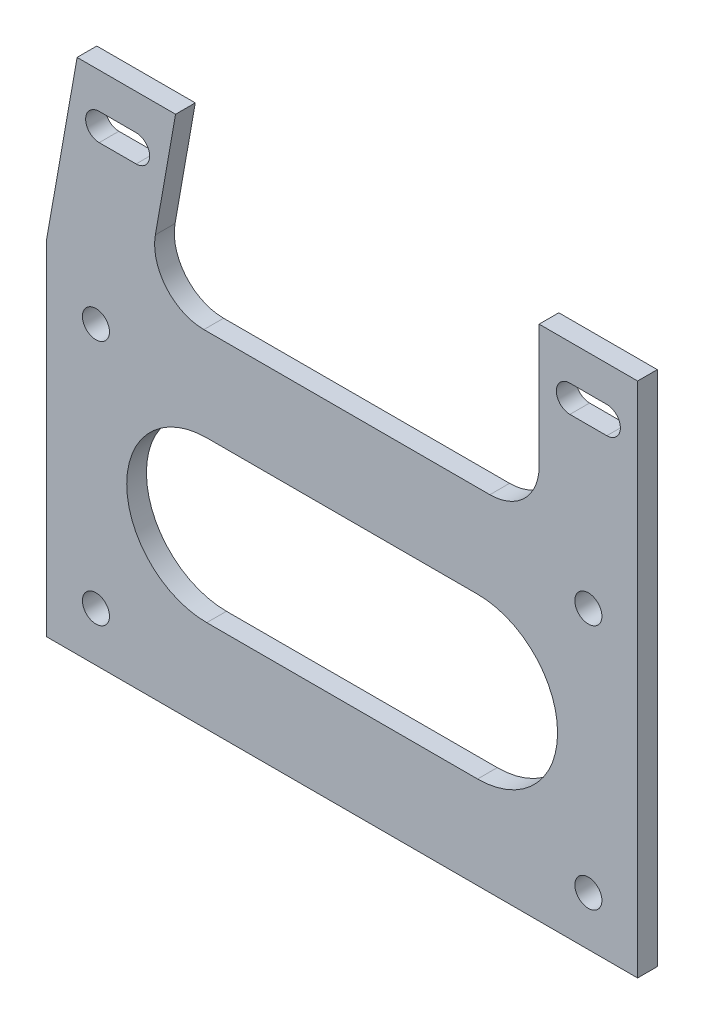
from build123d import *

# Parameters (mm, degrees)
SKETCH1_R           = 2.75
BOSS_EXTRUDE1_DEPTH = 4


with BuildPart() as part:
    # Sketch1 → Boss-Extrude1 (new body)
    with BuildSketch(Plane.XY):
        with BuildLine():
            Line((-60, 35), (-53.828555675, 70))
            Line((-53.828555675, 70), (-33.828555675, 70))
            Line((-33.828555675, 70), (-37.930541604, 46.736481777))
            ThreePointArc((-37.930541604, 46.736481777), (-35.742908505, 38.572123903), (-28.082464074, 35))
            Line((-28.082464074, 35), (30, 35))
            ThreePointArc((30, 35), (37.071067812, 37.928932188), (40, 45))
            Line((40, 45), (40, 70))
            Line((40, 70), (60, 70))
            Line((60, 70), (60, 35))
            Line((60, 35), (60, -35))
            Line((60, -35), (-60, -35))
            Line((-60, -35), (-60, 35))
        make_face()
        with Locations((-50, 25)):
            Circle(SKETCH1_R, mode=Mode.SUBTRACT)
        with Locations((-50, -25)):
            Circle(SKETCH1_R, mode=Mode.SUBTRACT)
        with Locations((50, 25)):
            Circle(SKETCH1_R, mode=Mode.SUBTRACT)
        with Locations((50, -25)):
            Circle(SKETCH1_R, mode=Mode.SUBTRACT)
        with BuildLine():
            Line((-49.341825482, 57.25), (-41.841825482, 57.25))
            ThreePointArc((-41.841825482, 57.25), (-39.091825482, 60), (-41.841825482, 62.75))
            Line((-41.841825482, 62.75), (-49.341825482, 62.75))
            ThreePointArc((-49.341825482, 62.75), (-52.091825482, 60), (-49.341825482, 57.25))
        make_face(mode=Mode.SUBTRACT)
        with BuildLine():
            Line((-27.5, -16.25), (27.5, -16.25))
            ThreePointArc((27.5, -16.25), (43.75, 0), (27.5, 16.25))
            Line((27.5, 16.25), (-27.5, 16.25))
            ThreePointArc((-27.5, 16.25), (-43.75, 0), (-27.5, -16.25))
        make_face(mode=Mode.SUBTRACT)
        with BuildLine():
            Line((46.25, 57.25), (53.75, 57.25))
            ThreePointArc((53.75, 57.25), (56.5, 60), (53.75, 62.75))
            Line((53.75, 62.75), (46.25, 62.75))
            ThreePointArc((46.25, 62.75), (43.5, 60), (46.25, 57.25))
        make_face(mode=Mode.SUBTRACT)
    extrude(amount=BOSS_EXTRUDE1_DEPTH)


solid = part.part
